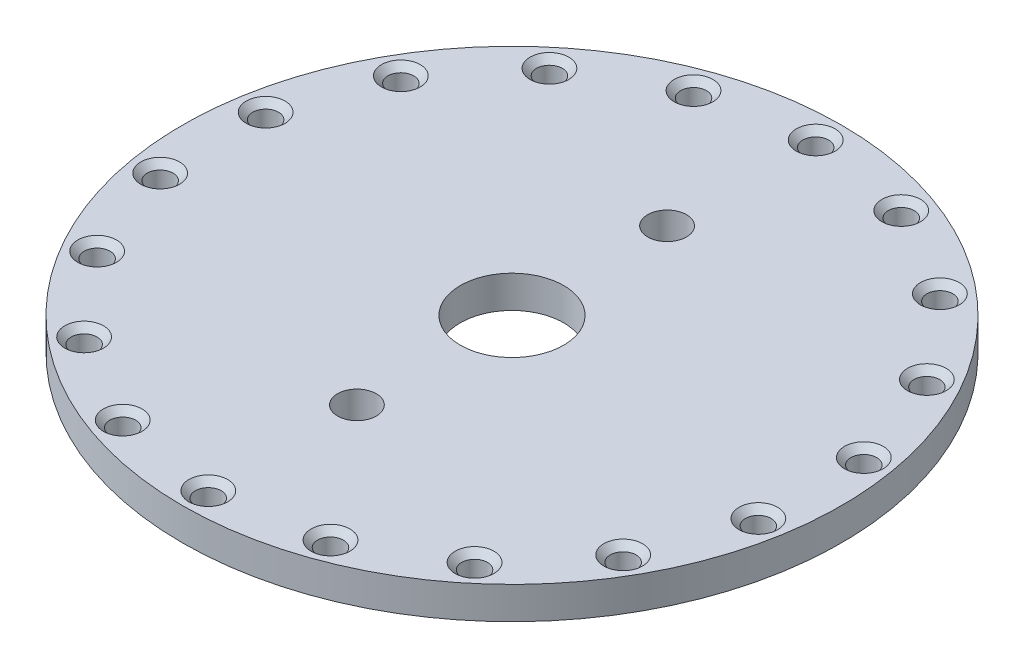
from build123d import *

# Parameters (mm, degrees)
SKETCH1_R           = 25.5
BOSS_EXTRUDE1_DEPTH = 2.5
CUT_EXTRUDE1_REACH  = 38.149
SKETCH2_R           = 4
CUT_EXTRUDE2_REACH  = 38.149
SKETCH3_R           = 1.5
CUT_EXTRUDE3_REACH  = 38.149
SKETCH4_R           = 1
CHAMFER1_SIZE       = 0.5


with BuildPart() as part:
    # Sketch1 → Boss-Extrude1 (new body)
    with BuildSketch(Plane(origin=(0, 0, 0), x_dir=(1, 0, 0), z_dir=(0, 1, 0))):
        with Locations(Location((0, 0, 0), (0, 0, 270))):
            Circle(SKETCH1_R)
    extrude(amount=BOSS_EXTRUDE1_DEPTH)

    # Sketch2 → Cut-Extrude1 (cut, up to next)
    with BuildSketch(Plane(origin=(0, 0, 0), x_dir=(1, 0, 0), z_dir=(0, 1, 0)), mode=Mode.PRIVATE) as cut_extrude1_sk1:
        with Locations(Location((0, 0, 0), (0, 0, 270))):
            Circle(SKETCH2_R)
    cut_extrude1_tool1 = extrude(cut_extrude1_sk1.sketch, amount=CUT_EXTRUDE1_REACH, mode=Mode.PRIVATE) & part.part
    add(cut_extrude1_tool1.solids().sort_by_distance((0, 0, 0))[0], mode=Mode.SUBTRACT)

    # Sketch3 → Cut-Extrude2 (cut, up to next)
    with BuildSketch(Plane(origin=(0, 0, 0), x_dir=(1, 0, 0), z_dir=(0, 1, 0)), mode=Mode.PRIVATE) as cut_extrude2_sk1:
        with Locations(Location((0, 12, 0), (0, 0, 270))):
            Circle(SKETCH3_R)
    cut_extrude2_tool1 = extrude(cut_extrude2_sk1.sketch, amount=CUT_EXTRUDE2_REACH, mode=Mode.PRIVATE) & part.part
    # Sketch3 → Cut-Extrude2 (cut, up to next)
    with BuildSketch(Plane(origin=(0, 0, 0), x_dir=(1, 0, 0), z_dir=(0, 1, 0)), mode=Mode.PRIVATE) as cut_extrude2_sk2:
        with Locations(Location((0, -12, 0), (0, 0, 270))):
            Circle(SKETCH3_R)
    cut_extrude2_tool2 = extrude(cut_extrude2_sk2.sketch, amount=CUT_EXTRUDE2_REACH, mode=Mode.PRIVATE) & part.part
    add(cut_extrude2_tool1.solids().sort_by_distance((0, 0, -12))[0], mode=Mode.SUBTRACT)
    add(cut_extrude2_tool2.solids().sort_by_distance((0, 0, 12))[0], mode=Mode.SUBTRACT)

    # Sketch4 → Cut-Extrude3 (cut, up to next)
    with BuildSketch(Plane(origin=(0, 0, 0), x_dir=(1, 0, 0), z_dir=(0, 1, 0)), mode=Mode.PRIVATE) as cut_extrude3_sk1:
        with Locations(Location((0, 23.5, 0), (0, 0, 270))):
            Circle(SKETCH4_R)
    cut_extrude3_tool1 = extrude(cut_extrude3_sk1.sketch, amount=CUT_EXTRUDE3_REACH, mode=Mode.PRIVATE) & part.part
    # Sketch4 → Cut-Extrude3 (cut, up to next)
    with BuildSketch(Plane(origin=(0, 0, 0), x_dir=(1, 0, 0), z_dir=(0, 1, 0)), mode=Mode.PRIVATE) as cut_extrude3_sk2:
        with Locations(Location((8.037473368, 22.082776588, 0), (0, 0, 270))):
            Circle(SKETCH4_R)
    cut_extrude3_tool2 = extrude(cut_extrude3_sk2.sketch, amount=CUT_EXTRUDE3_REACH, mode=Mode.PRIVATE) & part.part
    # Sketch4 → Cut-Extrude3 (cut, up to next)
    with BuildSketch(Plane(origin=(0, 0, 0), x_dir=(1, 0, 0), z_dir=(0, 1, 0)), mode=Mode.PRIVATE) as cut_extrude3_sk3:
        with Locations(Location((15.105508828, 18.002044413, 0), (0, 0, 270))):
            Circle(SKETCH4_R)
    cut_extrude3_tool3 = extrude(cut_extrude3_sk3.sketch, amount=CUT_EXTRUDE3_REACH, mode=Mode.PRIVATE) & part.part
    # Sketch4 → Cut-Extrude3 (cut, up to next)
    with BuildSketch(Plane(origin=(0, 0, 0), x_dir=(1, 0, 0), z_dir=(0, 1, 0)), mode=Mode.PRIVATE) as cut_extrude3_sk4:
        with Locations(Location((20.351596989, 11.75, 0), (0, 0, 270))):
            Circle(SKETCH4_R)
    cut_extrude3_tool4 = extrude(cut_extrude3_sk4.sketch, amount=CUT_EXTRUDE3_REACH, mode=Mode.PRIVATE) & part.part
    # Sketch4 → Cut-Extrude3 (cut, up to next)
    with BuildSketch(Plane(origin=(0, 0, 0), x_dir=(1, 0, 0), z_dir=(0, 1, 0)), mode=Mode.PRIVATE) as cut_extrude3_sk5:
        with Locations(Location((23.142982196, 4.080732175, 0), (0, 0, 270))):
            Circle(SKETCH4_R)
    cut_extrude3_tool5 = extrude(cut_extrude3_sk5.sketch, amount=CUT_EXTRUDE3_REACH, mode=Mode.PRIVATE) & part.part
    # Sketch4 → Cut-Extrude3 (cut, up to next)
    with BuildSketch(Plane(origin=(0, 0, 0), x_dir=(1, 0, 0), z_dir=(0, 1, 0)), mode=Mode.PRIVATE) as cut_extrude3_sk6:
        with Locations(Location((23.142982196, -4.080732175, 0), (0, 0, 270))):
            Circle(SKETCH4_R)
    cut_extrude3_tool6 = extrude(cut_extrude3_sk6.sketch, amount=CUT_EXTRUDE3_REACH, mode=Mode.PRIVATE) & part.part
    # Sketch4 → Cut-Extrude3 (cut, up to next)
    with BuildSketch(Plane(origin=(0, 0, 0), x_dir=(1, 0, 0), z_dir=(0, 1, 0)), mode=Mode.PRIVATE) as cut_extrude3_sk7:
        with Locations(Location((20.351596989, -11.75, 0), (0, 0, 270))):
            Circle(SKETCH4_R)
    cut_extrude3_tool7 = extrude(cut_extrude3_sk7.sketch, amount=CUT_EXTRUDE3_REACH, mode=Mode.PRIVATE) & part.part
    # Sketch4 → Cut-Extrude3 (cut, up to next)
    with BuildSketch(Plane(origin=(0, 0, 0), x_dir=(1, 0, 0), z_dir=(0, 1, 0)), mode=Mode.PRIVATE) as cut_extrude3_sk8:
        with Locations(Location((15.105508828, -18.002044413, 0), (0, 0, 270))):
            Circle(SKETCH4_R)
    cut_extrude3_tool8 = extrude(cut_extrude3_sk8.sketch, amount=CUT_EXTRUDE3_REACH, mode=Mode.PRIVATE) & part.part
    # Sketch4 → Cut-Extrude3 (cut, up to next)
    with BuildSketch(Plane(origin=(0, 0, 0), x_dir=(1, 0, 0), z_dir=(0, 1, 0)), mode=Mode.PRIVATE) as cut_extrude3_sk9:
        with Locations(Location((8.037473368, -22.082776588, 0), (0, 0, 270))):
            Circle(SKETCH4_R)
    cut_extrude3_tool9 = extrude(cut_extrude3_sk9.sketch, amount=CUT_EXTRUDE3_REACH, mode=Mode.PRIVATE) & part.part
    # Sketch4 → Cut-Extrude3 (cut, up to next)
    with BuildSketch(Plane(origin=(0, 0, 0), x_dir=(1, 0, 0), z_dir=(0, 1, 0)), mode=Mode.PRIVATE) as cut_extrude3_sk10:
        with Locations(Location((0, -23.5, 0), (0, 0, 270))):
            Circle(SKETCH4_R)
    cut_extrude3_tool10 = extrude(cut_extrude3_sk10.sketch, amount=CUT_EXTRUDE3_REACH, mode=Mode.PRIVATE) & part.part
    # Sketch4 → Cut-Extrude3 (cut, up to next)
    with BuildSketch(Plane(origin=(0, 0, 0), x_dir=(1, 0, 0), z_dir=(0, 1, 0)), mode=Mode.PRIVATE) as cut_extrude3_sk11:
        with Locations(Location((-8.037473368, -22.082776588, 0), (0, 0, 270))):
            Circle(SKETCH4_R)
    cut_extrude3_tool11 = extrude(cut_extrude3_sk11.sketch, amount=CUT_EXTRUDE3_REACH, mode=Mode.PRIVATE) & part.part
    # Sketch4 → Cut-Extrude3 (cut, up to next)
    with BuildSketch(Plane(origin=(0, 0, 0), x_dir=(1, 0, 0), z_dir=(0, 1, 0)), mode=Mode.PRIVATE) as cut_extrude3_sk12:
        with Locations(Location((-15.105508828, -18.002044413, 0), (0, 0, 270))):
            Circle(SKETCH4_R)
    cut_extrude3_tool12 = extrude(cut_extrude3_sk12.sketch, amount=CUT_EXTRUDE3_REACH, mode=Mode.PRIVATE) & part.part
    # Sketch4 → Cut-Extrude3 (cut, up to next)
    with BuildSketch(Plane(origin=(0, 0, 0), x_dir=(1, 0, 0), z_dir=(0, 1, 0)), mode=Mode.PRIVATE) as cut_extrude3_sk13:
        with Locations(Location((-20.351596989, -11.75, 0), (0, 0, 270))):
            Circle(SKETCH4_R)
    cut_extrude3_tool13 = extrude(cut_extrude3_sk13.sketch, amount=CUT_EXTRUDE3_REACH, mode=Mode.PRIVATE) & part.part
    # Sketch4 → Cut-Extrude3 (cut, up to next)
    with BuildSketch(Plane(origin=(0, 0, 0), x_dir=(1, 0, 0), z_dir=(0, 1, 0)), mode=Mode.PRIVATE) as cut_extrude3_sk14:
        with Locations(Location((-23.142982196, -4.080732175, 0), (0, 0, 270))):
            Circle(SKETCH4_R)
    cut_extrude3_tool14 = extrude(cut_extrude3_sk14.sketch, amount=CUT_EXTRUDE3_REACH, mode=Mode.PRIVATE) & part.part
    # Sketch4 → Cut-Extrude3 (cut, up to next)
    with BuildSketch(Plane(origin=(0, 0, 0), x_dir=(1, 0, 0), z_dir=(0, 1, 0)), mode=Mode.PRIVATE) as cut_extrude3_sk15:
        with Locations(Location((-23.142982196, 4.080732175, 0), (0, 0, 270))):
            Circle(SKETCH4_R)
    cut_extrude3_tool15 = extrude(cut_extrude3_sk15.sketch, amount=CUT_EXTRUDE3_REACH, mode=Mode.PRIVATE) & part.part
    # Sketch4 → Cut-Extrude3 (cut, up to next)
    with BuildSketch(Plane(origin=(0, 0, 0), x_dir=(1, 0, 0), z_dir=(0, 1, 0)), mode=Mode.PRIVATE) as cut_extrude3_sk16:
        with Locations(Location((-20.351596989, 11.75, 0), (0, 0, 270))):
            Circle(SKETCH4_R)
    cut_extrude3_tool16 = extrude(cut_extrude3_sk16.sketch, amount=CUT_EXTRUDE3_REACH, mode=Mode.PRIVATE) & part.part
    # Sketch4 → Cut-Extrude3 (cut, up to next)
    with BuildSketch(Plane(origin=(0, 0, 0), x_dir=(1, 0, 0), z_dir=(0, 1, 0)), mode=Mode.PRIVATE) as cut_extrude3_sk17:
        with Locations(Location((-15.105508828, 18.002044413, 0), (0, 0, 270))):
            Circle(SKETCH4_R)
    cut_extrude3_tool17 = extrude(cut_extrude3_sk17.sketch, amount=CUT_EXTRUDE3_REACH, mode=Mode.PRIVATE) & part.part
    # Sketch4 → Cut-Extrude3 (cut, up to next)
    with BuildSketch(Plane(origin=(0, 0, 0), x_dir=(1, 0, 0), z_dir=(0, 1, 0)), mode=Mode.PRIVATE) as cut_extrude3_sk18:
        with Locations(Location((-8.037473368, 22.082776588, 0), (0, 0, 270))):
            Circle(SKETCH4_R)
    cut_extrude3_tool18 = extrude(cut_extrude3_sk18.sketch, amount=CUT_EXTRUDE3_REACH, mode=Mode.PRIVATE) & part.part
    add(cut_extrude3_tool1.solids().sort_by_distance((0, 0, -23.5))[0], mode=Mode.SUBTRACT)
    add(cut_extrude3_tool2.solids().sort_by_distance((8.037473, 0, -22.082777))[0], mode=Mode.SUBTRACT)
    add(cut_extrude3_tool3.solids().sort_by_distance((15.105509, 0, -18.002044))[0], mode=Mode.SUBTRACT)
    add(cut_extrude3_tool4.solids().sort_by_distance((20.351597, 0, -11.75))[0], mode=Mode.SUBTRACT)
    add(cut_extrude3_tool5.solids().sort_by_distance((23.142982, 0, -4.080732))[0], mode=Mode.SUBTRACT)
    add(cut_extrude3_tool6.solids().sort_by_distance((23.142982, 0, 4.080732))[0], mode=Mode.SUBTRACT)
    add(cut_extrude3_tool7.solids().sort_by_distance((20.351597, 0, 11.75))[0], mode=Mode.SUBTRACT)
    add(cut_extrude3_tool8.solids().sort_by_distance((15.105509, 0, 18.002044))[0], mode=Mode.SUBTRACT)
    add(cut_extrude3_tool9.solids().sort_by_distance((8.037473, 0, 22.082777))[0], mode=Mode.SUBTRACT)
    add(cut_extrude3_tool10.solids().sort_by_distance((0, 0, 23.5))[0], mode=Mode.SUBTRACT)
    add(cut_extrude3_tool11.solids().sort_by_distance((-8.037473, 0, 22.082777))[0], mode=Mode.SUBTRACT)
    add(cut_extrude3_tool12.solids().sort_by_distance((-15.105509, 0, 18.002044))[0], mode=Mode.SUBTRACT)
    add(cut_extrude3_tool13.solids().sort_by_distance((-20.351597, 0, 11.75))[0], mode=Mode.SUBTRACT)
    add(cut_extrude3_tool14.solids().sort_by_distance((-23.142982, 0, 4.080732))[0], mode=Mode.SUBTRACT)
    add(cut_extrude3_tool15.solids().sort_by_distance((-23.142982, 0, -4.080732))[0], mode=Mode.SUBTRACT)
    add(cut_extrude3_tool16.solids().sort_by_distance((-20.351597, 0, -11.75))[0], mode=Mode.SUBTRACT)
    add(cut_extrude3_tool17.solids().sort_by_distance((-15.105509, 0, -18.002044))[0], mode=Mode.SUBTRACT)
    add(cut_extrude3_tool18.solids().sort_by_distance((-8.037473, 0, -22.082777))[0], mode=Mode.SUBTRACT)

    # Chamfer1
    chamfer1_edges = [part.edges().sort_by_distance(p)[0] for p in [
        (0, 0, -24.5),
        (0, 2.5, -24.5),
        (8.037473368, 0, -23.082776588),
        (8.037473368, 2.5, -23.082776588),
        (15.105508828, 0, -19.002044413),
        (15.105508828, 2.5, -19.002044413),
        (20.351596989, 0, -12.75),
        (20.351596989, 2.5, -12.75),
        (23.142982196, 0, -5.080732175),
        (23.142982196, 2.5, -5.080732175),
        (23.142982196, 0, 3.080732175),
        (23.142982196, 2.5, 3.080732175),
        (20.351596989, 0, 10.75),
        (20.351596989, 2.5, 10.75),
        (15.105508828, 0, 17.002044413),
        (15.105508828, 2.5, 17.002044413),
        (8.037473368, 0, 21.082776588),
        (8.037473368, 2.5, 21.082776588),
        (0, 0, 22.5),
        (0, 2.5, 22.5),
        (-8.037473368, 0, 21.082776588),
        (-8.037473368, 2.5, 21.082776588),
        (-15.105508828, 0, 17.002044413),
        (-15.105508828, 2.5, 17.002044413),
        (-20.351596989, 0, 10.75),
        (-20.351596989, 2.5, 10.75),
        (-23.142982196, 0, 3.080732175),
        (-23.142982196, 2.5, 3.080732175),
        (-23.142982196, 0, -5.080732175),
        (-23.142982196, 2.5, -5.080732175),
        (-20.351596989, 0, -12.75),
        (-20.351596989, 2.5, -12.75),
        (-15.105508828, 0, -19.002044413),
        (-15.105508828, 2.5, -19.002044413),
        (-8.037473368, 0, -23.082776588),
        (-8.037473368, 2.5, -23.082776588),
    ]]
    chamfer(chamfer1_edges, length=CHAMFER1_SIZE)


solid = part.part
